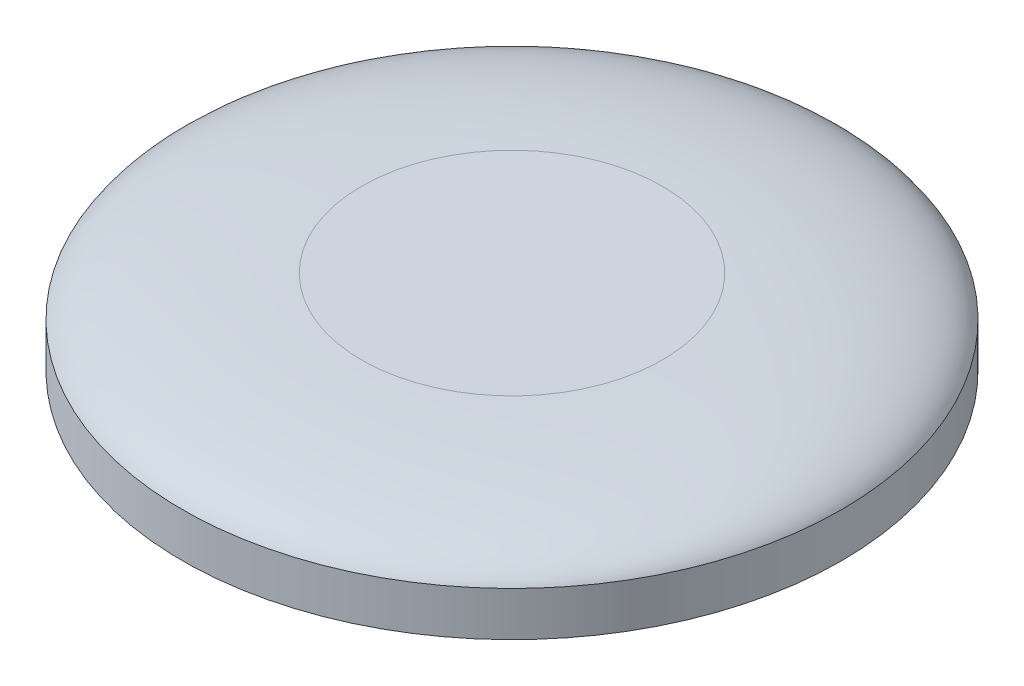
from build123d import *


with BuildPart() as part:
    # Esquisse1 → Révolution1 (revolve)
    with BuildSketch(Plane.XY):
        with BuildLine():
            Line((0, 0), (-11.414353025, 0))
            add(Edge.make_bspline(
                [(-11.414353025, 0), (-23.4645195, -0.324875606), (-25, -3.043224693)],
                knots=[0, 0, 0, 1, 1, 1], degree=2))
            Line((-25, -3.043224693), (-25, -6.405018167))
            Line((-25, -6.405018167), (-23, -6.405018167))
            Line((-23, -6.405018167), (-23, -5.405018167))
            Line((-23, -5.405018167), (-23.5, -5.405018167))
            Line((-23.5, -5.405018167), (-23.5, -3.405018167))
            Line((-23.5, -3.405018167), (-13.516966398, -1.56006451))
            Line((-13.516966398, -1.56006451), (0, -1.56006451))
            Line((0, -1.56006451), (0, 0))
        make_face()
    revolve(axis=Axis((0, 0, 0), (0, -1, 0)))


solid = part.part
